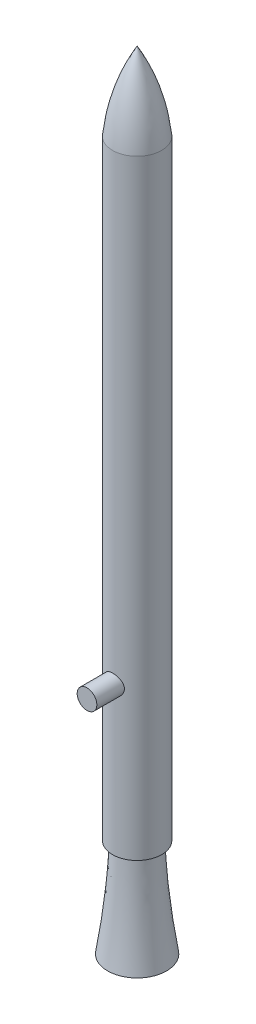
from build123d import *

# Parameters (mm, degrees)
SKETCH2_R           = 100
BOSS_EXTRUDE1_DEPTH = 510
SKETCH3_R           = 50
CUT_EXTRUDE1_DEPTH  = 510


with BuildPart() as part:
    # Sketch1 → Revolve1 (revolve)
    with BuildSketch(Plane.XY, mode=Mode.PRIVATE) as revolve1_sk:
        with BuildLine():
            Line((0, 8000), (0, 1000))
            Line((0, 1000), (50, 1000))
            add(Edge.make_bspline(
                [(50, 1000), (88.926420229, 498.892463954), (150, 0)],
                knots=[0, 0, 0, 1, 1, 1], degree=2))
            Line((150, 0), (300, 0))
            add(Edge.make_bspline(
                [(200, 1000), (219.10962266, 496.911485784), (300, 0)],
                knots=[0, 0, 0, 1, 1, 1], degree=2))
            Line((200, 1000), (250, 1000))
            Line((250, 1000), (250, 7205.045074908))
            add(Edge.make_bspline(
                [(0, 8000), (210.009020849, 7628.449489371), (250, 7205.045074908)],
                knots=[0, 0, 0, 1, 1, 1], degree=2))
        make_face()
    revolve(revolve1_sk.sketch.rotate(Axis((0, 402.495416157, 0), (0, -1, 0)), 90), axis=Axis((0, 402.495416157, 0), (0, -1, 0)))

    # Sketch2 → Boss-Extrude1 (add)
    with BuildSketch(Plane.XY):
        with Locations(Location((0, 2500, 0), (0, 0, 270))):
            Circle(SKETCH2_R)
    extrude(amount=BOSS_EXTRUDE1_DEPTH)

    # Sketch3 → Cut-Extrude1 (cut)
    with BuildSketch(Plane.XY):
        with Locations((0, 2500)):
            Circle(SKETCH3_R)
    extrude(amount=-CUT_EXTRUDE1_DEPTH, mode=Mode.SUBTRACT)


solid = part.part
